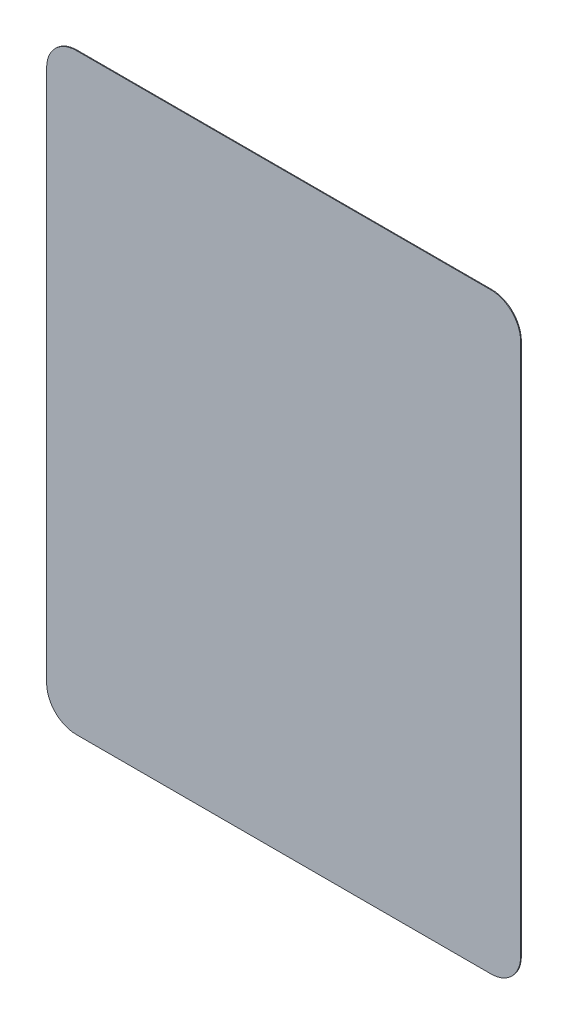
from build123d import *

# Parameters (mm, degrees)
BOSS_EXTRUDE1_DEPTH = 0.065


with BuildPart() as part:
    # Sketch1 → Boss-Extrude1 (new body)
    with BuildSketch(Plane.XY):
        with BuildLine():
            Line((-5, -25), (5, -25))
            Line((5, -25), (17.5, -25))
            ThreePointArc((17.5, -25), (19.267766953, -24.267766953), (20, -22.5))
            Line((20, -22.5), (20, 22.5))
            ThreePointArc((20, 22.5), (19.267766953, 24.267766953), (17.5, 25))
            Line((17.5, 25), (0, 25))
            Line((0, 25), (-17.5, 25))
            ThreePointArc((-17.5, 25), (-19.267766953, 24.267766953), (-20, 22.5))
            Line((-20, 22.5), (-20, -22.5))
            ThreePointArc((-20, -22.5), (-19.267766953, -24.267766953), (-17.5, -25))
            Line((-17.5, -25), (-5, -25))
        make_face()
    extrude(amount=BOSS_EXTRUDE1_DEPTH)


solid = part.part
